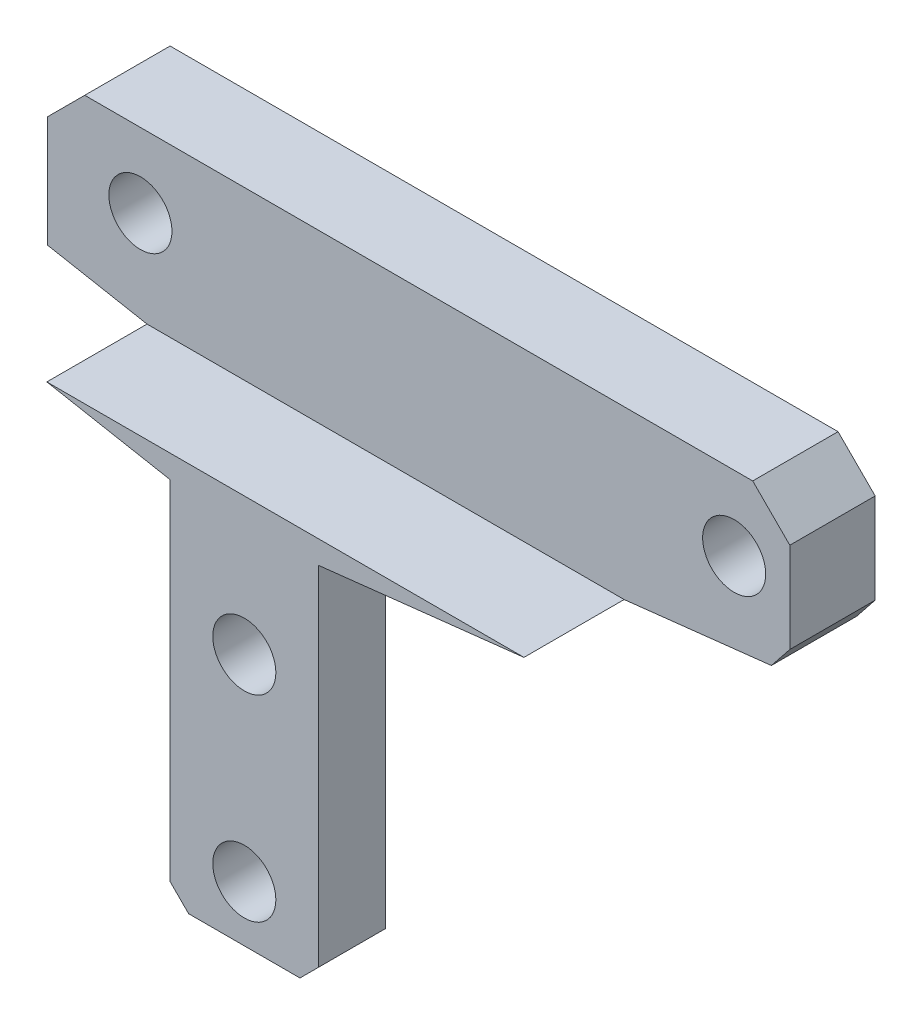
from build123d import *

# Parameters (mm, degrees)
SKETCH_1_R          = 0.85
EXTRUDE_2_DEPTH     = 5.5
SKETCH_3_W          = 4
SKETCH_3_H          = 9.88
SKETCH_3_R          = 0.85
CUT_EXTRUDE_2_DEPTH = 4.2
CHAMFER_1_SIZE      = 1
CHAMFER_2_SIZE      = 1
CHAMFER_3_SIZE      = 0.5
CUT_EXTRUDE_START   = -2.2
SKETCH_4_R          = 0.85
CUT_EXTRUDE_3_DEPTH = 2.2
CHAMFER_4_SIZE      = 0.5
CHAMFER_4_SIZE2     = 0.566583589
SKETCH_5_R          = 0.85
CUT_EXTRUDE_4_DEPTH = 1
SKETCH_6_R          = 0.85
EXTRUDE_3_DEPTH     = 0.5


with BuildPart() as part:
    # 草图1 → 凸台-拉伸2 (new body)
    with BuildSketch(Plane.XY):
        Polygon((-10, 2), (10, 2), (10, -2), (0, -3.12), (0, -13), (-4, -13), (-4, -3.12), (-10, -2), align=None)
        with Locations((-7.5, 0)):
            Circle(SKETCH_1_R, mode=Mode.SUBTRACT)
        with Locations((8.5, 0)):
            Circle(SKETCH_1_R, mode=Mode.SUBTRACT)
        with Locations((-2, -11.5)):
            Circle(SKETCH_1_R, mode=Mode.SUBTRACT)
        with Locations((-2, -6.2)):
            Circle(SKETCH_1_R, mode=Mode.SUBTRACT)
    extrude(amount=EXTRUDE_2_DEPTH)

    # 草图3 → 切除-拉伸2 (cut)
    with BuildSketch(Plane(origin=(0, 0, 0), x_dir=(-1, 0, 0), z_dir=(0, 0, -1))):
        with Locations((2, -8.06)):
            Rectangle(SKETCH_3_W, SKETCH_3_H)
        with Locations((2, -11.5)):
            Circle(SKETCH_3_R, mode=Mode.SUBTRACT)
        with Locations((2, -6.2)):
            Circle(SKETCH_3_R, mode=Mode.SUBTRACT)
    extrude(amount=-CUT_EXTRUDE_2_DEPTH, mode=Mode.SUBTRACT)

    # 倒角1
    chamfer_1_edges = [part.edges().sort_by_distance(p)[0] for p in [
        (-2, -3.12, 4.2),
    ]]
    chamfer(chamfer_1_edges, length=CHAMFER_1_SIZE)

    # 倒角2
    chamfer_2_edges = [part.edges().sort_by_distance(p)[0] for p in [
        (-10, 2, 2.75),
        (10, 2, 2.75),
    ]]
    chamfer(chamfer_2_edges, length=CHAMFER_2_SIZE)

    # 倒角3
    chamfer_3_edges = [part.edges().sort_by_distance(p)[0] for p in [
        (0, -13, 4.85),
        (-4, -13, 4.85),
    ]]
    chamfer(chamfer_3_edges, length=CHAMFER_3_SIZE)

    # 草图4 → 切除-拉伸3 (cut)
    with BuildSketch(Plane.XY.offset(5.5).offset(CUT_EXTRUDE_START)):
        Polygon((-10, -2.5), (10, -2.5), (10, 1), (9, 2), (-9, 2), (-10, 1), align=None)
        with Locations((8.5, 0)):
            Circle(SKETCH_4_R, mode=Mode.SUBTRACT)
        with Locations((-7.5, 0)):
            Circle(SKETCH_4_R, mode=Mode.SUBTRACT)
    extrude(amount=CUT_EXTRUDE_3_DEPTH, mode=Mode.SUBTRACT)

    # 倒角4
    chamfer_4_edges = [part.edges().sort_by_distance(p)[0] for p in [
        (10, -2, 1.65),
    ]]
    chamfer_4_side = [part.faces().sort_by_distance(p)[0] for p in [
        (4.398291925, -2.627391304, 2.391304348),
    ]]
    chamfer(chamfer_4_edges, length=CHAMFER_4_SIZE, length2=CHAMFER_4_SIZE2, reference=chamfer_4_side[0])

    # 草图5 → 切除-拉伸4 (cut)
    with BuildSketch(Plane(origin=(0, 0, 0), x_dir=(-1, 0, 0), z_dir=(0, 0, -1))):
        Polygon((-10, 1), (-10, -1.433416411), (-9.503106802, -2.055652038), (0, -3.12), (4, -3.12), (10, -2), (10, 1), (9, 2), (-9, 2), align=None)
        with Locations((7.5, 0)):
            Circle(SKETCH_5_R, mode=Mode.SUBTRACT)
        with Locations((-8.5, 0)):
            Circle(SKETCH_5_R, mode=Mode.SUBTRACT)
    extrude(amount=-CUT_EXTRUDE_4_DEPTH, mode=Mode.SUBTRACT)

    # 草图6 → 凸台-拉伸3 (add)
    with BuildSketch(Plane.XY.offset(5.5)):
        Polygon((0, -3.12), (5.535714286, -2.5), (-7.321428571, -2.5), (-4, -3.12), (-4, -12.5), (-3.5, -13), (-0.5, -13), (0, -12.5), align=None)
        with Locations(Location((-2, -11.5, 0), (0, 0, 180))):
            Circle(SKETCH_6_R, mode=Mode.SUBTRACT)
        with Locations(Location((-2, -6.2, 0), (0, 0, 180))):
            Circle(SKETCH_6_R, mode=Mode.SUBTRACT)
    extrude(amount=EXTRUDE_3_DEPTH)


solid = part.part
